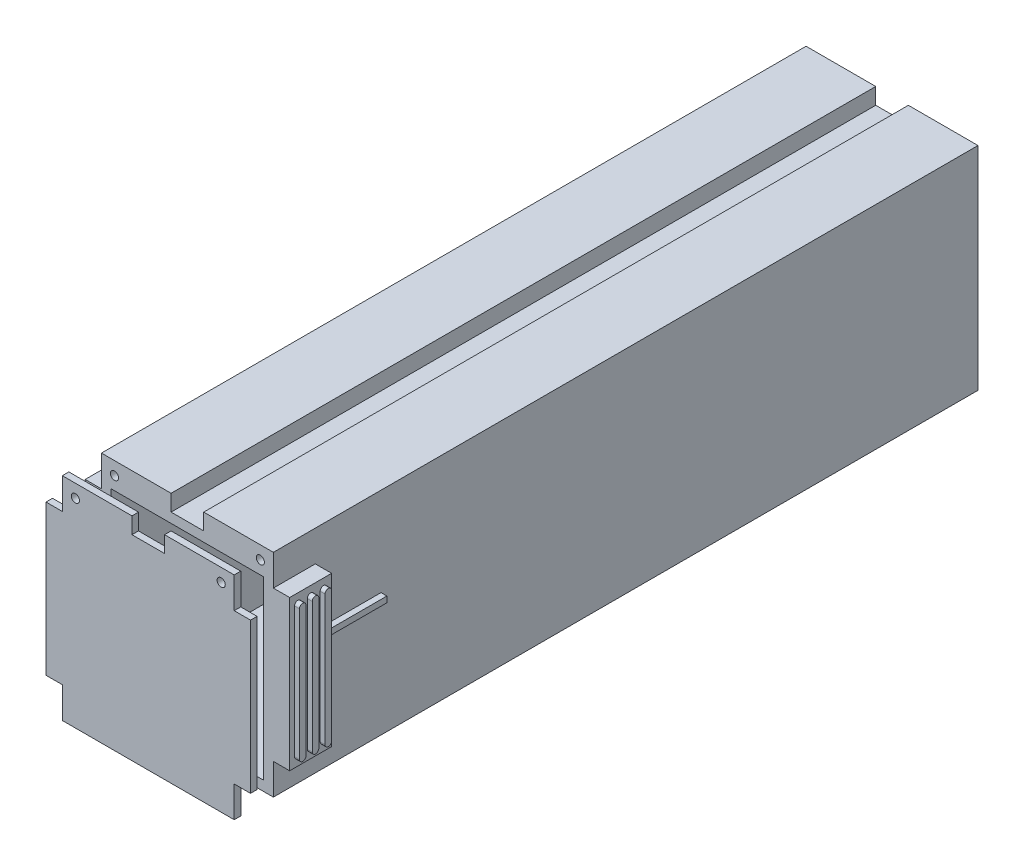
from build123d import *

# Parameters (mm, degrees)
SKETCH_1_W          = 52.7
SKETCH_1_H          = 65
EXTRUDE_1_DEPTH     = 216
SKETCH_2_W          = 10
SKETCH_2_H          = 5
CUT_EXTRUDE_1_DEPTH = 232.642591075
SKETCH_3_W          = 46.7
SKETCH_3_H          = 54
CUT_EXTRUDE_2_DEPTH = 211
SKETCH_6_R          = 1.75
SKETCH_6_W          = 16
SKETCH_6_H          = 16
CUT_EXTRUDE_3_DEPTH = 5
SKETCH_7_W          = 1.8
SKETCH_7_H          = 1.8
EXTRUDE_2_DEPTH     = 33
SKETCH_9_W          = 12.85
SKETCH_9_H          = 46
EXTRUDE_3_DEPTH     = 5
SKETCH_10_W         = 12.85
SKETCH_10_H         = 46
EXTRUDE_4_DEPTH     = 5
EXTRUDE_5_DEPTH     = 1.5
EXTRUDE_START       = 1.5
EXTRUDE_6_DEPTH     = 1.5
EXTRUDE_7_DEPTH     = 2
SKETCH_15_R         = 1.25
CUT_EXTRUDE_4_DEPTH = 20


with BuildPart() as part:
    # 草图1 → 凸台-拉伸1 (new body)
    with BuildSketch(Plane.XY):
        with Locations((26.35, 32.5)):
            Rectangle(SKETCH_1_W, SKETCH_1_H)
    extrude(amount=EXTRUDE_1_DEPTH)

    # 草图2 → 切除-拉伸1 (cut, through all)
    with BuildSketch(Plane.XY.offset(216)):
        with Locations((26.35, 62.5)):
            Rectangle(SKETCH_2_W, SKETCH_2_H)
    extrude(amount=-CUT_EXTRUDE_1_DEPTH, mode=Mode.SUBTRACT)

    # 草图3 → 切除-拉伸2 (cut)
    with BuildSketch(Plane.XY.offset(216)):
        with Locations((26.35, 30)):
            Rectangle(SKETCH_3_W, SKETCH_3_H)
    extrude(amount=-CUT_EXTRUDE_2_DEPTH, mode=Mode.SUBTRACT)

    # 草图6 → 切除-拉伸3 (cut)
    with BuildSketch(Plane(origin=(0, 0, 0), x_dir=(-1, 0, 0), z_dir=(0, 0, -1))):
        with Locations((-13.6, 14.2)):
            Circle(SKETCH_6_R)
        with Locations((-39.1, 14.2)):
            Circle(SKETCH_6_R)
        with Locations((-26.35, 14.2)):
            Rectangle(SKETCH_6_W, SKETCH_6_H)
    extrude(amount=-CUT_EXTRUDE_3_DEPTH, mode=Mode.SUBTRACT)

    # 草图7 → 凸台-拉伸2 (add)
    with BuildSketch(Plane.XY.offset(216)):
        with Locations((53.6, 36.9)):
            Rectangle(SKETCH_7_W, SKETCH_7_H)
    extrude(amount=-EXTRUDE_2_DEPTH)

    # 草图9 → 凸台-拉伸3 (add)
    with BuildSketch(Plane.ZY):
        with Locations((209.575, 32.5)):
            Rectangle(SKETCH_9_W, SKETCH_9_H)
    extrude(amount=EXTRUDE_3_DEPTH)

    # 草图10 → 凸台-拉伸4 (add)
    with BuildSketch(Plane(origin=(52.7, 0, 0), x_dir=(0, 0, -1), z_dir=(1, 0, 0))):
        with Locations((-209.575, 32.5)):
            Rectangle(SKETCH_10_W, SKETCH_10_H)
    extrude(amount=EXTRUDE_4_DEPTH)

    # 草图11 → 凸台-拉伸5 (add)
    with BuildSketch(Plane(origin=(57.7, 0, 0), x_dir=(0, 0, -1), z_dir=(1, 0, 0))):
        with BuildLine():
            Line((-214.5, 12.5), (-214.5, 52.5))
            ThreePointArc((-214.5, 52.5), (-213.5, 53.5), (-212.5, 52.5))
            Line((-212.5, 52.5), (-212.5, 12.5))
            ThreePointArc((-212.5, 12.5), (-213.5, 11.5), (-214.5, 12.5))
        make_face()
        with BuildLine():
            Line((-210.575, 12.5), (-210.575, 52.5))
            ThreePointArc((-210.575, 52.5), (-209.575, 53.5), (-208.575, 52.5))
            Line((-208.575, 52.5), (-208.575, 12.5))
            ThreePointArc((-208.575, 12.5), (-209.575, 11.5), (-210.575, 12.5))
        make_face()
        with BuildLine():
            Line((-206.65, 12.5), (-206.65, 52.5))
            ThreePointArc((-206.65, 52.5), (-205.65, 53.5), (-204.65, 52.5))
            Line((-204.65, 52.5), (-204.65, 12.5))
            ThreePointArc((-204.65, 12.5), (-205.65, 11.5), (-206.65, 12.5))
        make_face()
    extrude(amount=EXTRUDE_5_DEPTH)

    # 草图12 → 凸台-拉伸6 (add)
    with BuildSketch(Plane.ZY.offset(5).offset(EXTRUDE_START)):
        with BuildLine():
            Line((214.5, 12.5), (214.5, 52.5))
            ThreePointArc((214.5, 52.5), (213.5, 53.5), (212.5, 52.5))
            Line((212.5, 52.5), (212.5, 12.5))
            ThreePointArc((212.5, 12.5), (213.5, 11.5), (214.5, 12.5))
        make_face()
        with BuildLine():
            Line((206.65, 12.5), (206.65, 52.5))
            ThreePointArc((206.65, 52.5), (205.65, 53.5), (204.65, 52.5))
            Line((204.65, 52.5), (204.65, 12.5))
            ThreePointArc((204.65, 12.5), (205.65, 11.5), (206.65, 12.5))
        make_face()
        with BuildLine():
            Line((210.575, 12.5), (210.575, 52.5))
            ThreePointArc((210.575, 52.5), (209.575, 53.5), (208.575, 52.5))
            Line((208.575, 52.5), (208.575, 12.5))
            ThreePointArc((208.575, 12.5), (209.575, 11.5), (210.575, 12.5))
        make_face()
    extrude(amount=-EXTRUDE_6_DEPTH)


with BuildPart() as body_2:
    # 草图14 → 凸台-拉伸7 (new body)
    with BuildSketch(Plane.XY.offset(226)):
        Polygon((57.7, 55.5), (52.7, 55.5), (52.7, 65), (31.35, 65), (31.35, 60), (21.35, 60), (21.35, 65), (0, 65), (0, 55.5), (-5, 55.5), (-5, 9.5), (0, 9.5), (0, 0), (52.7, 0), (52.7, 9.5), (57.7, 9.5), align=None)
    extrude(amount=EXTRUDE_7_DEPTH)


with BuildPart() as cut_extrude_4_tool:
    # 草图15 → 切除-拉伸4 (new body)
    with BuildSketch(Plane.XY.offset(228)):
        with Locations((4, 61)):
            Circle(SKETCH_15_R)
        with Locations((48.7, 61)):
            Circle(SKETCH_15_R)
    extrude(amount=-CUT_EXTRUDE_4_DEPTH)


with BuildPart() as part_1:
    add(part.part)

    # 切除-拉伸4: cut by cut_extrude_4_tool
    add(cut_extrude_4_tool.part, mode=Mode.SUBTRACT)


with BuildPart() as body_2_1:
    add(body_2.part)

    # 切除-拉伸4: cut by cut_extrude_4_tool
    add(cut_extrude_4_tool.part, mode=Mode.SUBTRACT)


solid = Compound([part_1.part, body_2_1.part])
